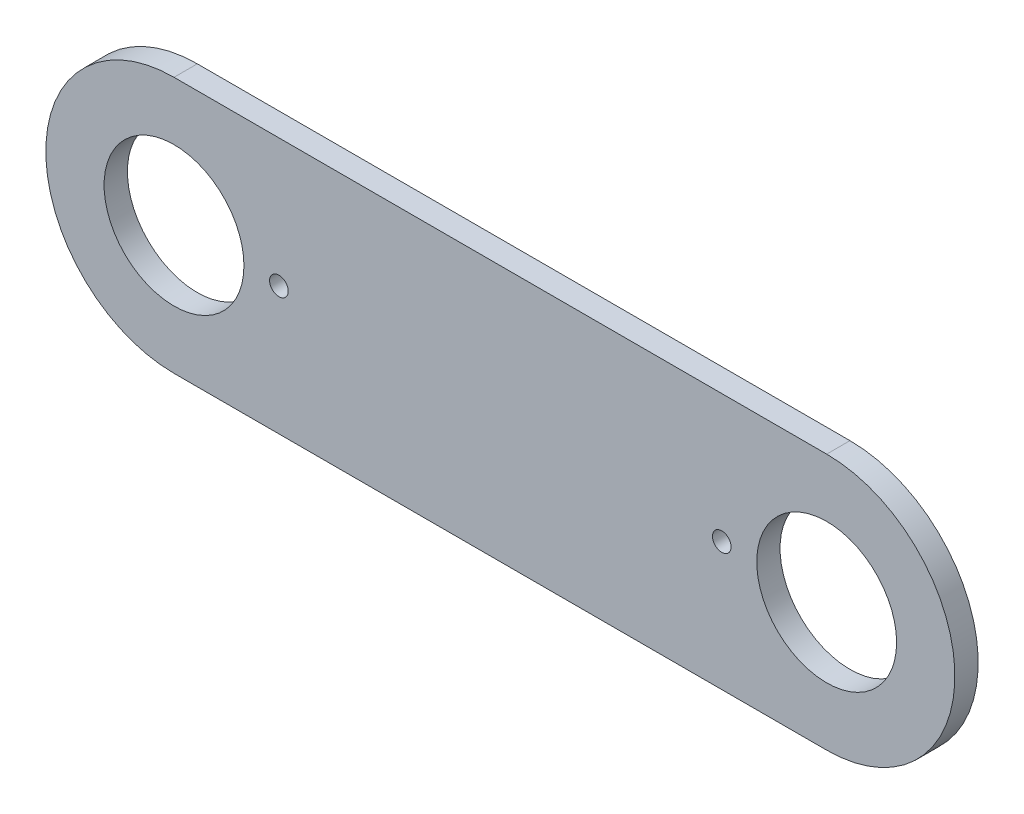
from build123d import *

# Parameters (mm, degrees)
SKETCH_1_R      = 15
SKETCH_1_R_2    = 2
EXTRUDE_1_DEPTH = 5


with BuildPart() as part:
    # 草图1 → 凸台-拉伸1 (new body)
    with BuildSketch(Plane.XY):
        with BuildLine():
            Line((0, 27.5), (140, 27.5))
            ThreePointArc((140, 27.5), (167.5, 0), (140, -27.5))
            Line((140, -27.5), (0, -27.5))
            ThreePointArc((0, -27.5), (-27.5, 0), (0, 27.5))
        make_face()
        Circle(SKETCH_1_R, mode=Mode.SUBTRACT)
        with Locations((140, 0)):
            Circle(SKETCH_1_R, mode=Mode.SUBTRACT)
        with Locations((22.5, 0)):
            Circle(SKETCH_1_R_2, mode=Mode.SUBTRACT)
        with Locations((117.5, 0)):
            Circle(SKETCH_1_R_2, mode=Mode.SUBTRACT)
    extrude(amount=EXTRUDE_1_DEPTH)


solid = part.part
